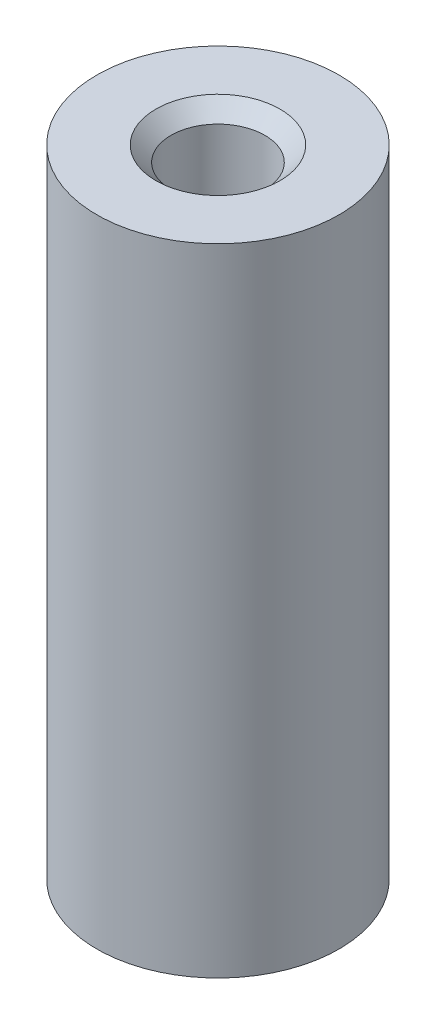
from build123d import *

# Parameters (mm, degrees)
SKIZZE1_R                        = 4
AUFSATZ_LINEAR_AUSTRAGEN1_DEPTH  = 21
F_3_1_3_1_DURCHMESSER_BOHRUNG1_D = 3.1
FASE1_SIZE                       = 0.5


with BuildPart() as part:
    # Skizze1 → Aufsatz-Linear austragen1 (new body)
    with BuildSketch(Plane(origin=(0, 0, 0), x_dir=(1, 0, 0), z_dir=(0, 1, 0))):
        with Locations(Location((0, 0, 0), (0, 0, 90))):
            Circle(SKIZZE1_R)
    extrude(amount=AUFSATZ_LINEAR_AUSTRAGEN1_DEPTH)

    # Ø3.1 (3.1) Durchmesser Bohrung1 (through all)
    with Locations(Plane(origin=(0, 21, 0), x_dir=(1, 0, 0), z_dir=(0, 1, 0))):
        with Locations((0, 0)):
            Hole(F_3_1_3_1_DURCHMESSER_BOHRUNG1_D / 2)

    # Fase1
    fase1_edges = [part.edges().sort_by_distance(p)[0] for p in [
        (1.55, 21, 0),
        (1.55, 0, 0),
    ]]
    chamfer(fase1_edges, length=FASE1_SIZE)


solid = part.part
